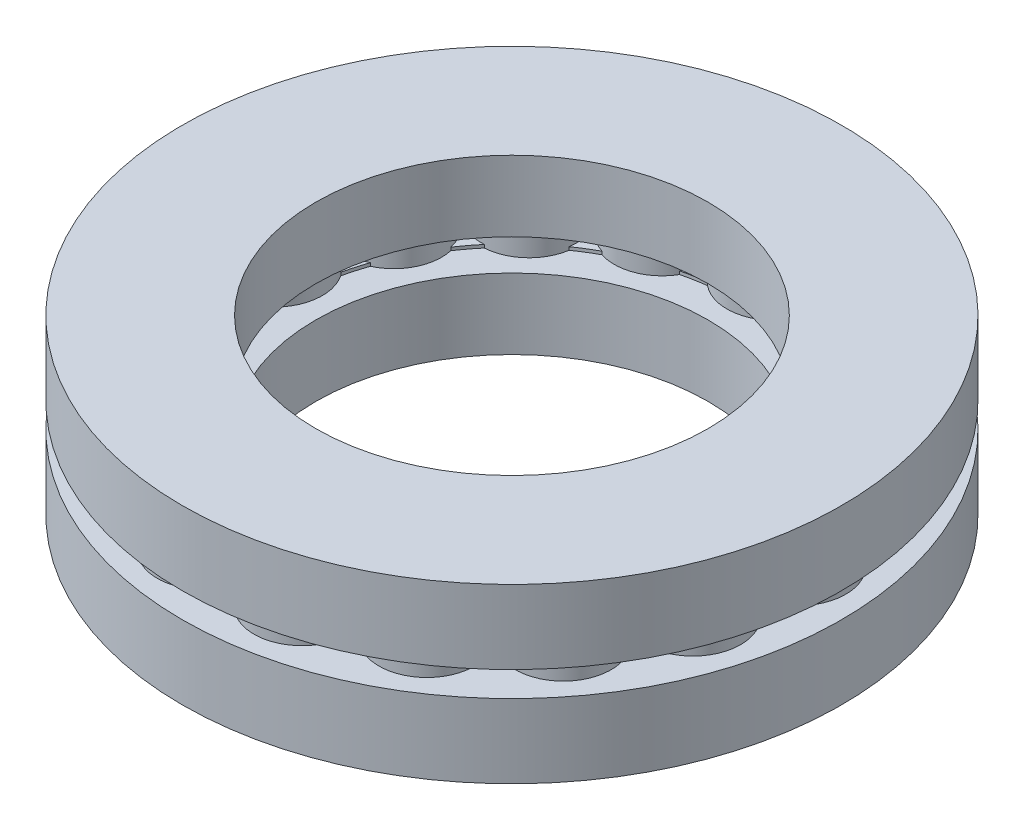
from build123d import *

# Parameters (mm, degrees)
SKETCH_1_R      = 21
SKETCH_1_R_2    = 12.5
EXTRUDE_1_DEPTH = 4.5
SKETCH_2_R      = 3.05
EXTRUDE_3_DEPTH = 3.5
SKETCH_3_R      = 21
SKETCH_3_R_2    = 14.5
EXTRUDE_4_DEPTH = 0.2
SKETCH_5_R      = 21
SKETCH_5_R_2    = 14.5
EXTRUDE_8_DEPTH = 0.2
SKETCH_6_R      = 21
SKETCH_6_R_2    = 12.5
EXTRUDE_9_DEPTH = 4.5


with BuildPart() as part:
    # 草图1 → 凸台-拉伸1 (new body)
    with BuildSketch(Plane(origin=(0, 0, 0), x_dir=(1, 0, 0), z_dir=(0, 1, 0))):
        with Locations(Location((0, 0, 0), (0, 0, 270))):
            Circle(SKETCH_1_R)
        with Locations(Location((0, 0, 0), (0, 0, 270))):
            Circle(SKETCH_1_R_2, mode=Mode.SUBTRACT)
    extrude(amount=EXTRUDE_1_DEPTH)

    # 草图2 → 凸台-拉伸3 (add)
    with BuildSketch(Plane(origin=(0, 4.5, 0), x_dir=(1, 0, 0), z_dir=(0, 1, 0))):
        with Locations(Location((0, 16.75, 0), (0, 0, 270))):
            Circle(SKETCH_2_R)
        with Locations(Location((6.050797909, 15.618909843, 0), (0, 0, 270))):
            Circle(SKETCH_2_R)
        with Locations(Location((11.284402031, 12.378399363, 0), (0, 0, 270))):
            Circle(SKETCH_2_R)
        with Locations(Location((14.99398513, 7.466117459, 0), (0, 0, 270))):
            Circle(SKETCH_2_R)
        with Locations(Location((16.678547453, 1.545495021, 0), (0, 0, 270))):
            Circle(SKETCH_2_R)
        with Locations(Location((16.110579523, -4.583855084, 0), (0, 0, 270))):
            Circle(SKETCH_2_R)
        with Locations(Location((13.366788557, -10.094130159, 0), (0, 0, 270))):
            Circle(SKETCH_2_R)
        with Locations(Location((8.817738728, -14.241137023, 0), (0, 0, 270))):
            Circle(SKETCH_2_R)
        with Locations(Location((3.077804423, -16.46479942, 0), (0, 0, 270))):
            Circle(SKETCH_2_R)
        with Locations(Location((-3.077804423, -16.46479942, 0), (0, 0, 270))):
            Circle(SKETCH_2_R)
        with Locations(Location((-8.817738728, -14.241137023, 0), (0, 0, 270))):
            Circle(SKETCH_2_R)
        with Locations(Location((-13.366788557, -10.094130159, 0), (0, 0, 270))):
            Circle(SKETCH_2_R)
        with Locations(Location((-16.110579523, -4.583855084, 0), (0, 0, 270))):
            Circle(SKETCH_2_R)
        with Locations(Location((-16.678547453, 1.545495021, 0), (0, 0, 270))):
            Circle(SKETCH_2_R)
        with Locations(Location((-14.99398513, 7.466117459, 0), (0, 0, 270))):
            Circle(SKETCH_2_R)
        with Locations(Location((-11.284402031, 12.378399363, 0), (0, 0, 270))):
            Circle(SKETCH_2_R)
        with Locations(Location((-6.050797909, 15.618909843, 0), (0, 0, 270))):
            Circle(SKETCH_2_R)
    extrude(amount=EXTRUDE_3_DEPTH)

    # 草图5 → 凸台-拉伸8 (add)
    with BuildSketch(Plane(origin=(0, 4.5, 0), x_dir=(1, 0, 0), z_dir=(0, 1, 0))):
        with Locations(Location((0, 0, 0), (0, 0, 270))):
            Circle(SKETCH_5_R)
        with Locations(Location((0, 0, 0), (0, 0, 270))):
            Circle(SKETCH_5_R_2, mode=Mode.SUBTRACT)
    extrude(amount=EXTRUDE_8_DEPTH)



with BuildPart() as body_2:
    # 草图3 → 凸台-拉伸4 (new body)
    with BuildSketch(Plane(origin=(0, 6.5, 0), x_dir=(1, 0, 0), z_dir=(0, 1, 0))):
        with Locations(Location((0, 0, 0), (0, 0, 270))):
            Circle(SKETCH_3_R)
        with Locations(Location((0, 0, 0), (0, 0, 270))):
            Circle(SKETCH_3_R_2, mode=Mode.SUBTRACT)
    extrude(amount=-EXTRUDE_4_DEPTH)


with BuildPart() as part_1:
    add(part.part)

    add(body_2.part)  # 凸台-拉伸9 merges body 2
    # 草图6 → 凸台-拉伸9 (add)
    with BuildSketch(Plane(origin=(0, 6.5, 0), x_dir=(1, 0, 0), z_dir=(0, 1, 0))):
        with Locations(Location((0, 0, 0), (0, 0, 270))):
            Circle(SKETCH_6_R)
        with Locations(Location((0, 0, 0), (0, 0, 270))):
            Circle(SKETCH_6_R_2, mode=Mode.SUBTRACT)
    extrude(amount=EXTRUDE_9_DEPTH)


solid = part_1.part
